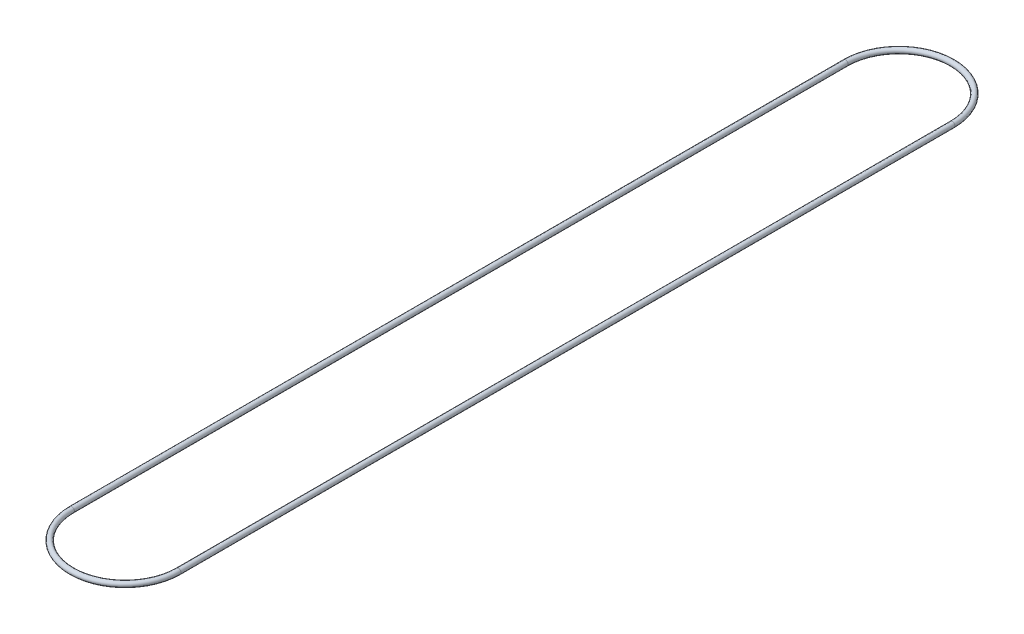
from build123d import *

# Parameters (mm, degrees)
ESQUISSE2_R = 0.25


with BuildPart() as part:
    # Balayage1: sweep along a path in Esquisse1
    with BuildLine(Plane(origin=(0, 0, 0), x_dir=(1, 0, 0), z_dir=(0, 1, 0))) as balayage1_path:
        Line((-5, 0), (-5, -72.509034))
        ThreePointArc((-5, -72.509034), (0, -77.509034), (5, -72.509034))
        Line((5, -72.509034), (5, 0))
        ThreePointArc((5, 0), (0, 5), (-5, 0))
    # Esquisse2 → Balayage1 (sweep)
    with BuildSketch(Plane.XY):
        with Locations((-5, 0)):
            Circle(ESQUISSE2_R)
    sweep(path=balayage1_path.line)


solid = part.part
